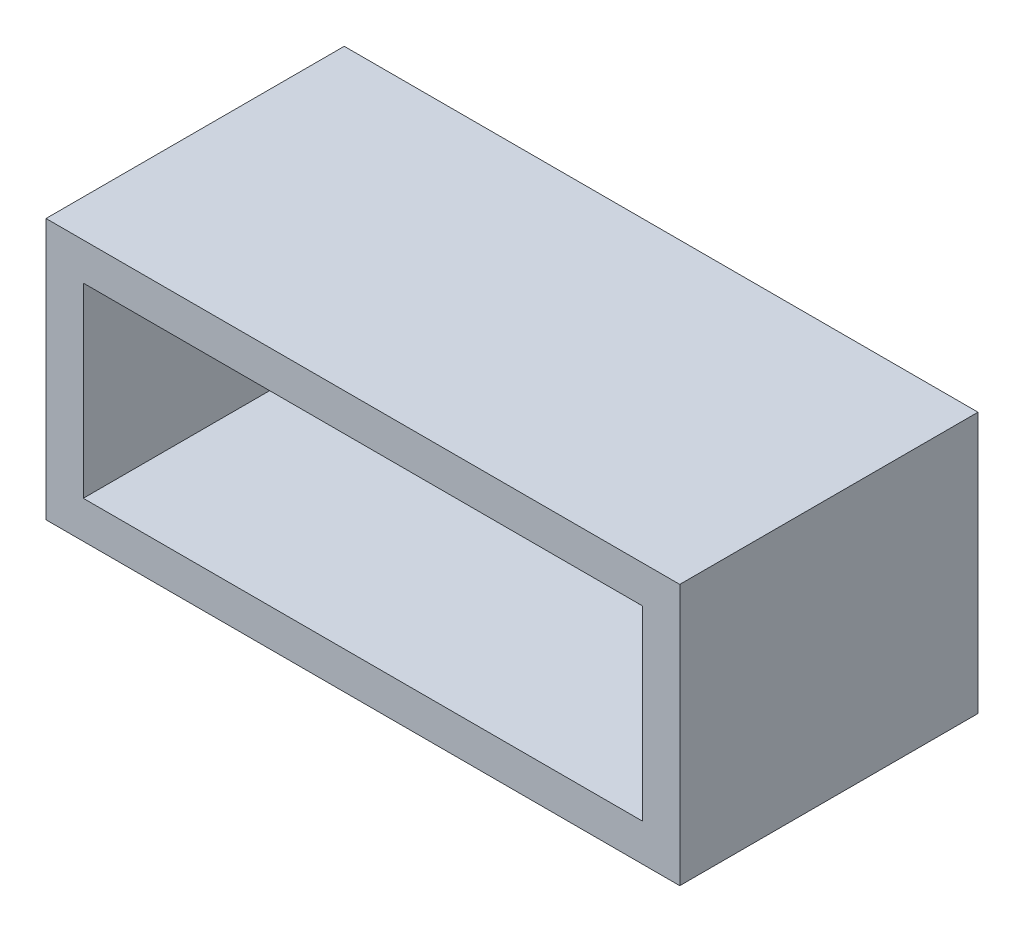
from build123d import *

# Parameters (mm, degrees)
SKETCH1_W           = 170
SKETCH1_H           = 70
SKETCH1_W_2         = 150
SKETCH1_H_2         = 50
BOSS_EXTRUDE1_DEPTH = 80
SKETCH2_W           = 10
SKETCH2_H           = 13
BOSS_EXTRUDE2_DEPTH = 15
SKETCH3_R           = 2.381541705
CUT_EXTRUDE1_DEPTH  = 15


with BuildPart() as part:
    # Sketch1 → Boss-Extrude1 (new body)
    with BuildSketch(Plane.XY):
        Rectangle(SKETCH1_W, SKETCH1_H)
        Rectangle(SKETCH1_W_2, SKETCH1_H_2, mode=Mode.SUBTRACT)
    extrude(amount=BOSS_EXTRUDE1_DEPTH)

    # Sketch2 → Boss-Extrude2 (add)
    with BuildSketch(Plane.ZY.offset(-75)):
        with Locations((5, 18.5)):
            Rectangle(SKETCH2_W, SKETCH2_H)
    boss_extrude2 = extrude(amount=BOSS_EXTRUDE2_DEPTH)

    # Sketch3 → Cut-Extrude1 (cut)
    with BuildSketch(Plane(origin=(0, 0, 0), x_dir=(-1, 0, 0), z_dir=(0, 0, -1))):
        with Locations((-69.43110047, 20.059908975)):
            Circle(SKETCH3_R)
    cut_extrude1 = extrude(amount=-CUT_EXTRUDE1_DEPTH, mode=Mode.SUBTRACT)

    # Mirror1: Boss-Extrude2, Cut-Extrude1 across plane
    add(boss_extrude2.mirror(Plane(origin=(0, 0, 0), x_dir=(0, 0, 1), z_dir=(1, 0, 0))))
    add(cut_extrude1.mirror(Plane(origin=(0, 0, 0), x_dir=(0, 0, 1), z_dir=(1, 0, 0))), mode=Mode.SUBTRACT)


solid = part.part
